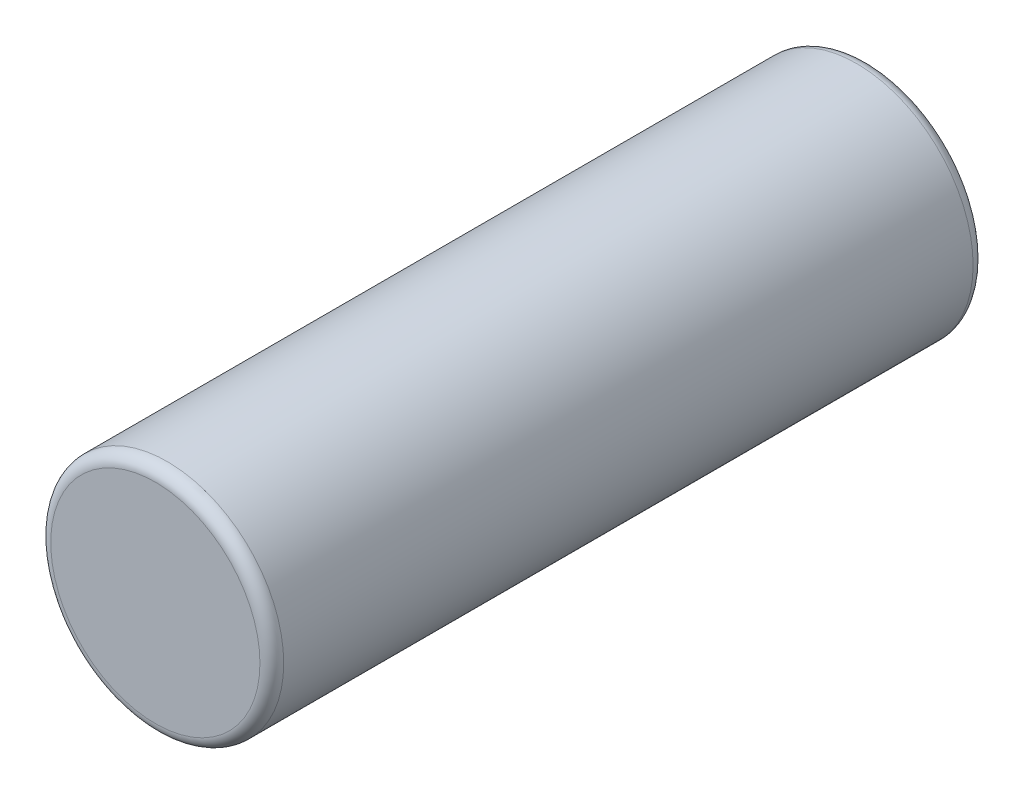
from build123d import *

# Parameters (mm, degrees)
SKETCH_1_R      = 2.45
EXTRUDE_1_DEPTH = 15
FILLET_1_R      = 0.25


with BuildPart() as part:
    # 스케치1 → 보스-돌출1 (new body)
    with BuildSketch(Plane.XY):
        Circle(SKETCH_1_R)
    extrude(amount=EXTRUDE_1_DEPTH)

    # 필렛1
    fillet_1_edges = [part.edges().sort_by_distance(p)[0] for p in [
        (-2.45, 0, 0),
        (-2.45, 0, 15),
    ]]
    fillet(fillet_1_edges, radius=FILLET_1_R)


solid = part.part
